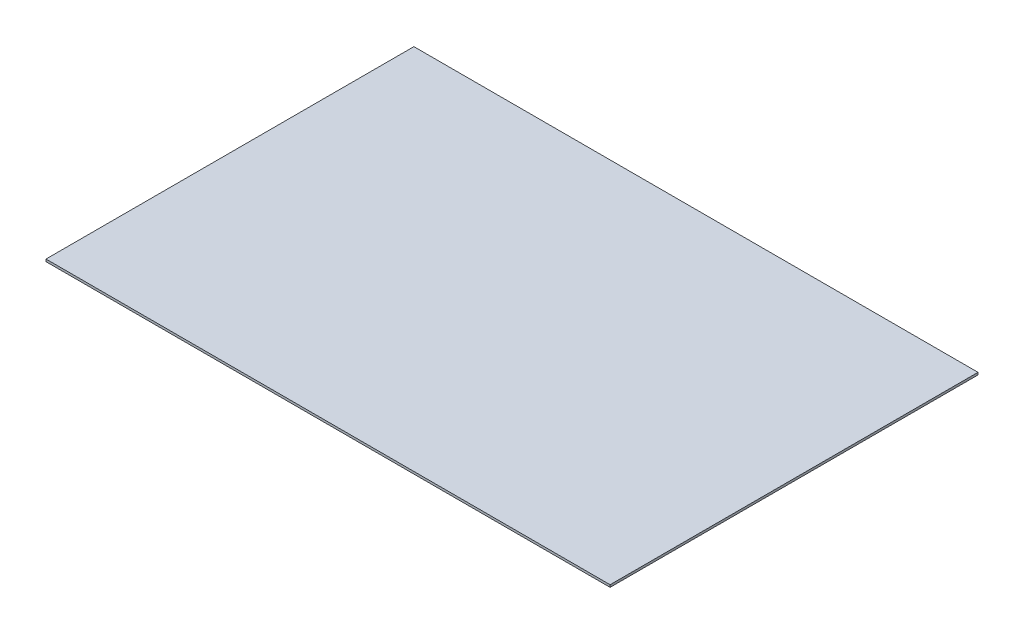
from build123d import *

# Parameters (mm, degrees)
SKETCH1_W           = 1168.4
SKETCH1_H           = 762
BOSS_EXTRUDE1_DEPTH = 4.7625


with BuildPart() as part:
    # Sketch1 → Boss-Extrude1 (new body)
    with BuildSketch(Plane(origin=(0, 0, 0), x_dir=(1, 0, 0), z_dir=(0, 1, 0))):
        Rectangle(SKETCH1_W, SKETCH1_H)
    extrude(amount=BOSS_EXTRUDE1_DEPTH)


solid = part.part
